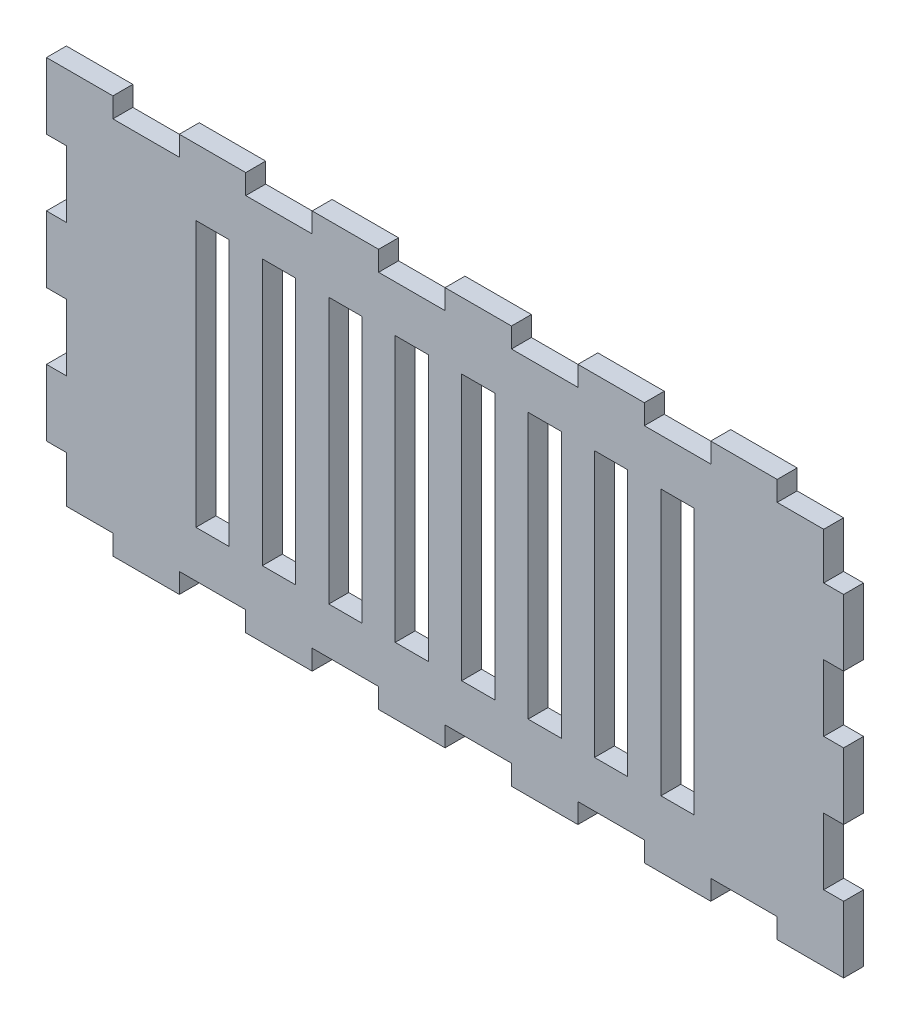
from build123d import *

# Parameters (mm, degrees)
BOSS_EXTRUDE1_DEPTH = 3
SKETCH2_W           = 5
SKETCH2_H           = 40
CUT_EXTRUDE1_DEPTH  = 10


with BuildPart() as part:
    # Sketch1 → Boss-Extrude1 (new body)
    with BuildSketch(Plane.XY):
        Polygon((120, 0), (120, 10), (117, 10), (117, 20), (120, 20), (120, 30), (117, 30), (117, 40), (120, 40), (120, 50), (117, 50), (117, 57), (110, 57), (110, 60), (100, 60), (100, 57), (90, 57), (90, 60), (80, 60), (80, 57), (70, 57), (70, 60), (60, 60), (60, 57), (50, 57), (50, 60), (40, 60), (40, 57), (30, 57), (30, 60), (20, 60), (20, 57), (10, 57), (10, 60), (0, 60), (0, 50), (3, 50), (3, 40), (0, 40), (0, 30), (3, 30), (3, 20), (0, 20), (0, 10), (3, 10), (3, 3), (10, 3), (10, 0), (20, 0), (20, 3), (30, 3), (30, 0), (40, 0), (40, 3), (50, 3), (50, 0), (60, 0), (60, 3), (70, 3), (70, 0), (80, 0), (80, 3), (90, 3), (90, 0), (100, 0), (100, 3), (110, 3), (110, 0), align=None)
    extrude(amount=BOSS_EXTRUDE1_DEPTH)

    # Sketch2 → Cut-Extrude1 (cut)
    with BuildSketch(Plane.XY.offset(3)):
        with Locations((25, 30)):
            Rectangle(SKETCH2_W, SKETCH2_H)
        with Locations((35, 30)):
            Rectangle(SKETCH2_W, SKETCH2_H)
        with Locations((45, 30)):
            Rectangle(SKETCH2_W, SKETCH2_H)
        with Locations((55, 30)):
            Rectangle(SKETCH2_W, SKETCH2_H)
        with Locations((65, 30)):
            Rectangle(SKETCH2_W, SKETCH2_H)
        with Locations((75, 30)):
            Rectangle(SKETCH2_W, SKETCH2_H)
        with Locations((85, 30)):
            Rectangle(SKETCH2_W, SKETCH2_H)
        with Locations((95, 30)):
            Rectangle(SKETCH2_W, SKETCH2_H)
    extrude(amount=-CUT_EXTRUDE1_DEPTH, mode=Mode.SUBTRACT)


solid = part.part
